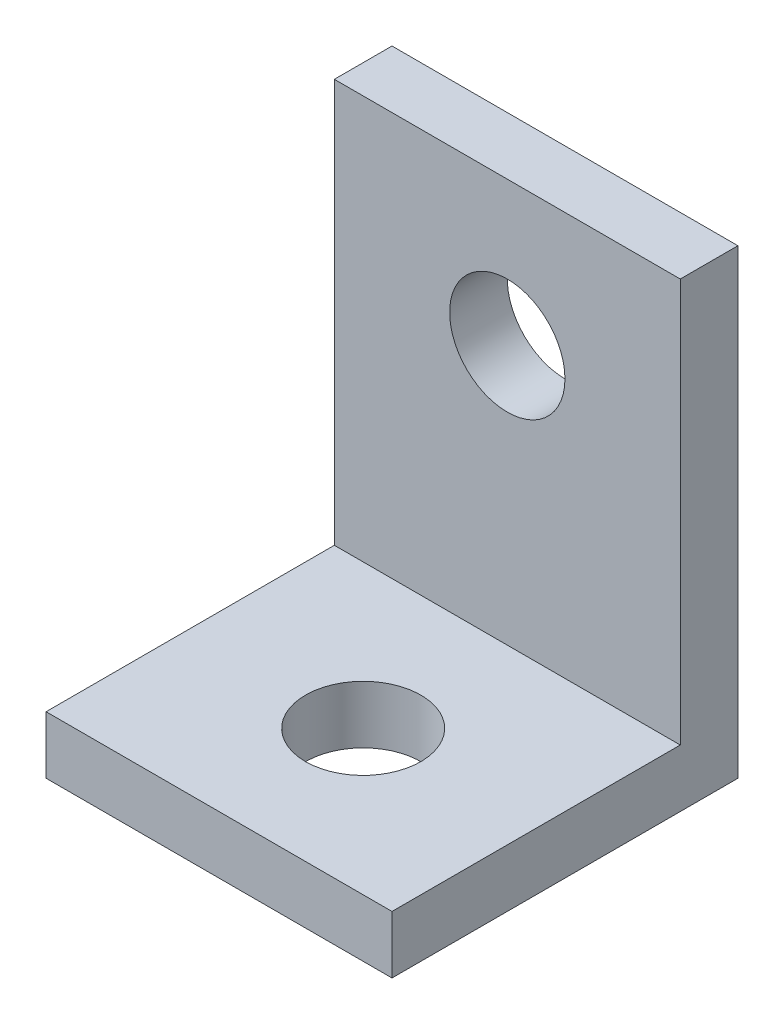
from build123d import *

# Parameters (mm, degrees)
SKETCH1_W           = 19.05
SKETCH1_H           = 19.05
BOSS_EXTRUDE1_DEPTH = 3.175
SKETCH2_W           = 19.05
SKETCH2_H           = 3.175
BOSS_EXTRUDE2_DEPTH = 22.225
CUT_EXTRUDE1_REACH  = 36.925
SKETCH3_R           = 3.175
CUT_EXTRUDE2_REACH  = 37.498
SKETCH4_R           = 3.175


with BuildPart() as part:
    # Sketch1 → Boss-Extrude1 (new body)
    with BuildSketch(Plane(origin=(0, 0, 0), x_dir=(1, 0, 0), z_dir=(0, 1, 0))):
        with Locations((9.525, -9.525)):
            Rectangle(SKETCH1_W, SKETCH1_H)
    extrude(amount=BOSS_EXTRUDE1_DEPTH)

    # Sketch2 → Boss-Extrude2 (add)
    with BuildSketch(Plane(origin=(0, 3.175, 0), x_dir=(1, 0, 0), z_dir=(0, 1, 0))):
        with Locations((9.525, -1.5875)):
            Rectangle(SKETCH2_W, SKETCH2_H)
    extrude(amount=BOSS_EXTRUDE2_DEPTH)

    # Sketch3 → Cut-Extrude1 (cut, up to next)
    with BuildSketch(Plane(origin=(0, 3.175, 0), x_dir=(1, 0, 0), z_dir=(0, 1, 0)), mode=Mode.PRIVATE) as cut_extrude1_sk1:
        with Locations(Location((9.525, -11.1125, 0), (0, 0, 270))):
            Circle(SKETCH3_R)
    cut_extrude1_tool1 = extrude(cut_extrude1_sk1.sketch, amount=-CUT_EXTRUDE1_REACH, mode=Mode.PRIVATE) & part.part
    add(cut_extrude1_tool1.solids().sort_by_distance((9.525, 3.175, 11.1125))[0], mode=Mode.SUBTRACT)

    # Sketch4 → Cut-Extrude2 (cut, up to next)
    with BuildSketch(Plane.XY.offset(3.175), mode=Mode.PRIVATE) as cut_extrude2_sk1:
        with Locations((9.525, 17.4625)):
            Circle(SKETCH4_R)
    cut_extrude2_tool1 = extrude(cut_extrude2_sk1.sketch, amount=-CUT_EXTRUDE2_REACH, mode=Mode.PRIVATE) & part.part
    add(cut_extrude2_tool1.solids().sort_by_distance((9.525, 17.4625, 3.175))[0], mode=Mode.SUBTRACT)


solid = part.part
